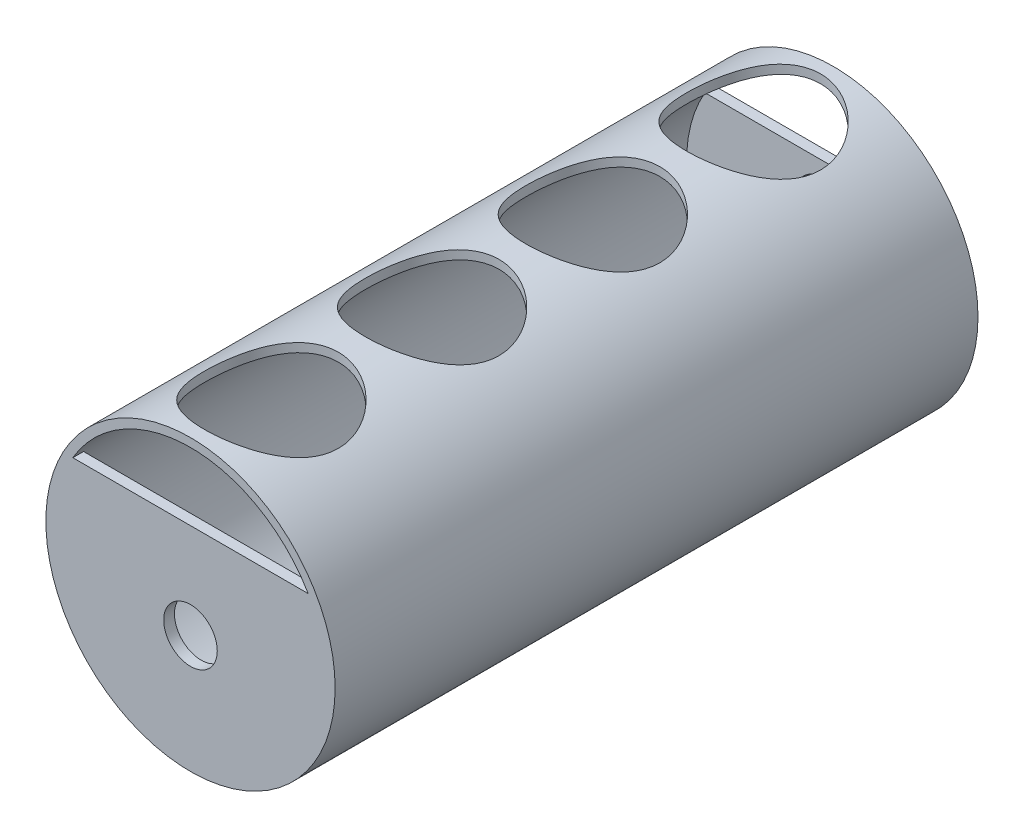
from build123d import *

# Parameters (mm, degrees)
SKETCH1_R           = 27
SKETCH1_R_2         = 25.4
EXTRUDE_THIN1_DEPTH = 120
BOSS_EXTRUDE1_START = -2
BOSS_EXTRUDE1_DEPTH = 2
BOSS_EXTRUDE2_DEPTH = 2
SKETCH4_R           = 12.5
CUT_EXTRUDE2_DEPTH  = 31
SKETCH5_R           = 5
CUT_EXTRUDE3_DEPTH  = 18
SKETCH6_R           = 5
CUT_EXTRUDE4_DEPTH  = 18


with BuildPart() as part:
    # Sketch1 → Extrude-Thin1 (new body)
    with BuildSketch(Plane.XY):
        Circle(SKETCH1_R)
        Circle(SKETCH1_R_2, mode=Mode.SUBTRACT)
    extrude(amount=EXTRUDE_THIN1_DEPTH)

    # Sketch2 → Boss-Extrude1 (add)
    with BuildSketch(Plane.XY.offset(120).offset(BOSS_EXTRUDE1_START)):
        with BuildLine():
            Line((21.964447337, 12.756294649), (-21.964447337, 12.756294649))
            ThreePointArc((-21.964447337, 12.756294649), (-6.60541587, -24.526077574), (25.4, 0))
            ThreePointArc((25.4, 0), (24.526077574, 6.60541587), (21.964447337, 12.756294649))
        make_face()
    extrude(amount=BOSS_EXTRUDE1_DEPTH)

    # Sketch3 → Boss-Extrude2 (add)
    with BuildSketch(Plane(origin=(0, 0, 0), x_dir=(-1, 0, 0), z_dir=(0, 0, -1))):
        with BuildLine():
            ThreePointArc((25.4, 0), (24.526077574, 6.60541587), (21.964447337, 12.756294649))
            Line((21.964447337, 12.756294649), (-21.964447337, 12.756294649))
            ThreePointArc((-21.964447337, 12.756294649), (-6.60541587, -24.526077574), (25.4, 0))
        make_face()
    extrude(amount=-BOSS_EXTRUDE2_DEPTH)

    # Sketch4 → Cut-Extrude2 (cut)
    with BuildSketch(Plane(origin=(0, 0, 0), x_dir=(1, 0, 0), z_dir=(0, 1, 0))):
        with Locations(Location((0, -14.899672821, 0), (0, 0, 90))):
            Circle(SKETCH4_R)
        with Locations(Location((0, -44.899672821, 0), (0, 0, 90))):
            Circle(SKETCH4_R)
        with Locations(Location((0, -74.899672821, 0), (0, 0, 90))):
            Circle(SKETCH4_R)
        with Locations(Location((0, -104.899672821, 0), (0, 0, 90))):
            Circle(SKETCH4_R)
    extrude(amount=CUT_EXTRUDE2_DEPTH, mode=Mode.SUBTRACT)

    # Sketch5 → Cut-Extrude3 (cut)
    with BuildSketch(Plane(origin=(0, 0, 0), x_dir=(-1, 0, 0), z_dir=(0, 0, -1))):
        with Locations((0, 5)):
            Circle(SKETCH5_R)
    extrude(amount=-CUT_EXTRUDE3_DEPTH, mode=Mode.SUBTRACT)

    # Sketch6 → Cut-Extrude4 (cut)
    with BuildSketch(Plane.XY.offset(120)):
        with Locations((0, -5)):
            Circle(SKETCH6_R)
    extrude(amount=-CUT_EXTRUDE4_DEPTH, mode=Mode.SUBTRACT)


solid = part.part
